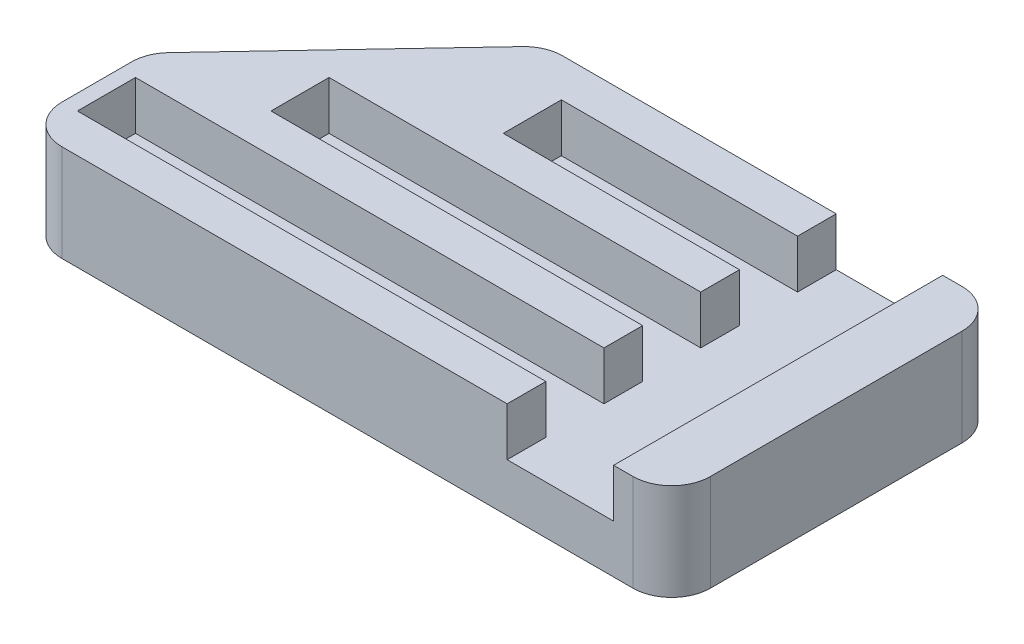
from build123d import *

# Parameters (mm, degrees)
EXTRUDE_1_DEPTH = 2.5
SKETCH_1_3_W    = 3
SKETCH_1_3_H    = 17
EXTRUDE_2_DEPTH = 2.5
FILLET_1_R      = 2


with BuildPart() as part:
    # Эскиз1 → Бобышка-Вытянуть1 (new body)
    with BuildSketch(Plane(origin=(0, 0, 0), x_dir=(1, 0, 0), z_dir=(0, 1, 0))):
        Polygon((-25, 0), (8.5, 0), (8.5, 17), (-15, 17), (-25, 6.390453713), align=None)
    extrude(amount=-EXTRUDE_1_DEPTH)

    # Эскиз1<3> → Бобышка-Вытянуть2 (add)
    with BuildSketch(Plane(origin=(0, 0, 0), x_dir=(1, 0, 0), z_dir=(0, 1, 0))):
        Polygon((0, 15), (0, 17), (-15, 17), (-25, 6.390453713), (-25, 0), (0, 0), (0, 2), (-24.2, 2), (-24.2, 5), (0, 5), (0, 7), (-19.2, 7), (-19.2, 10), (0, 10), (0, 12), (-12.2, 12), (-12.2, 15), align=None)
        with Locations((7, 8.5)):
            Rectangle(SKETCH_1_3_W, SKETCH_1_3_H)
    extrude(amount=EXTRUDE_2_DEPTH)

    # Скругление1
    fillet_1_edges = [part.edges().sort_by_distance(p)[0] for p in [
        (8.5, 0, 0),
        (8.5, 0, -17),
        (-25, 0, 0),
        (-15, 0, -17),
        (-25, 0, -6.390453713),
    ]]
    fillet(fillet_1_edges, radius=FILLET_1_R)


solid = part.part
